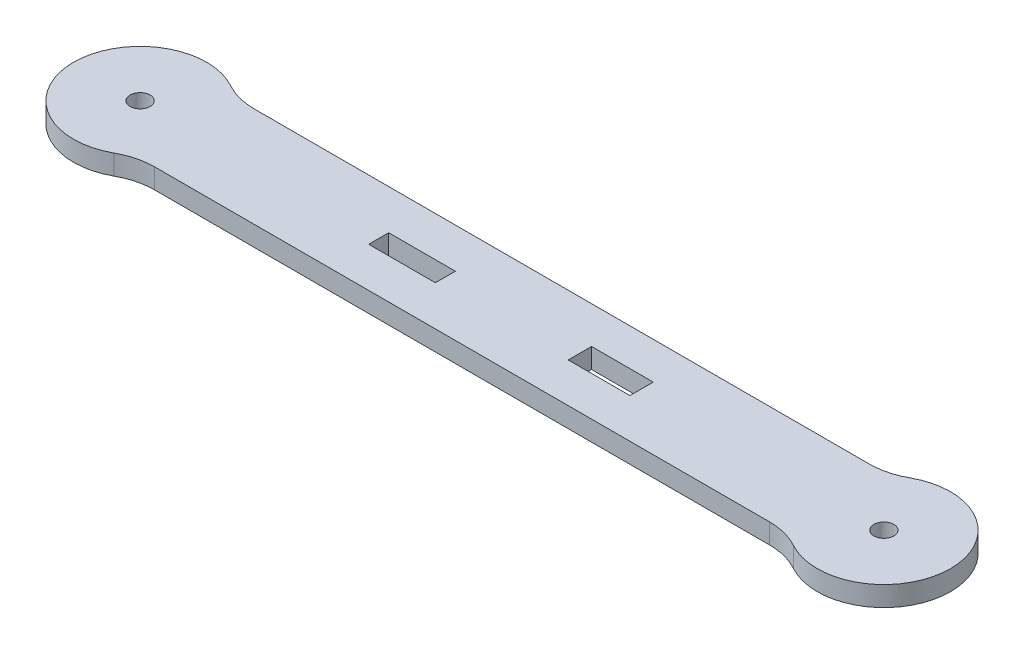
from build123d import *

# Parameters (mm, degrees)
SKETCH_1_R      = 1.5
SKETCH_1_W      = 10
SKETCH_1_H      = 3
SKETCH_1_W_2    = 9.259227657
SKETCH_1_H_2    = 3.503491546
EXTRUDE_1_DEPTH = 3
FILLET_1_R      = 10


with BuildPart() as part:
    # 草图1 → 凸台-拉伸1 (new body)
    with BuildSketch(Plane(origin=(0, 0, 0), x_dir=(1, 0, 0), z_dir=(0, 1, 0))):
        with BuildLine():
            Line((-49.19123706, -7.5), (49.19123706, -7.5))
            ThreePointArc((49.19123706, -7.5), (65.805615338, 0), (49.19123706, 7.5))
            Line((49.19123706, 7.5), (-49.19123706, 7.5))
            ThreePointArc((-49.19123706, 7.5), (-65.805615338, 0), (-49.19123706, -7.5))
        make_face()
        with Locations(Location((-55.805615338, 0, 0), (0, 0, 270))):
            Circle(SKETCH_1_R, mode=Mode.SUBTRACT)
        with Locations(Location((55.805615338, 0, 0), (0, 0, 270))):
            Circle(SKETCH_1_R, mode=Mode.SUBTRACT)
        with Locations((-15, 0)):
            Rectangle(SKETCH_1_W, SKETCH_1_H, mode=Mode.SUBTRACT)
        with Locations((14.629613829, 0.187687047)):
            Rectangle(SKETCH_1_W_2, SKETCH_1_H_2, mode=Mode.SUBTRACT)
    extrude(amount=EXTRUDE_1_DEPTH)

    # 圆角1
    fillet_1_edges = [part.edges().sort_by_distance(p)[0] for p in [
        (-49.19123706, 1.5, -7.5),
        (49.19123706, 1.5, -7.5),
        (49.19123706, 1.5, 7.5),
        (-49.19123706, 1.5, 7.5),
    ]]
    fillet(fillet_1_edges, radius=FILLET_1_R)


solid = part.part
